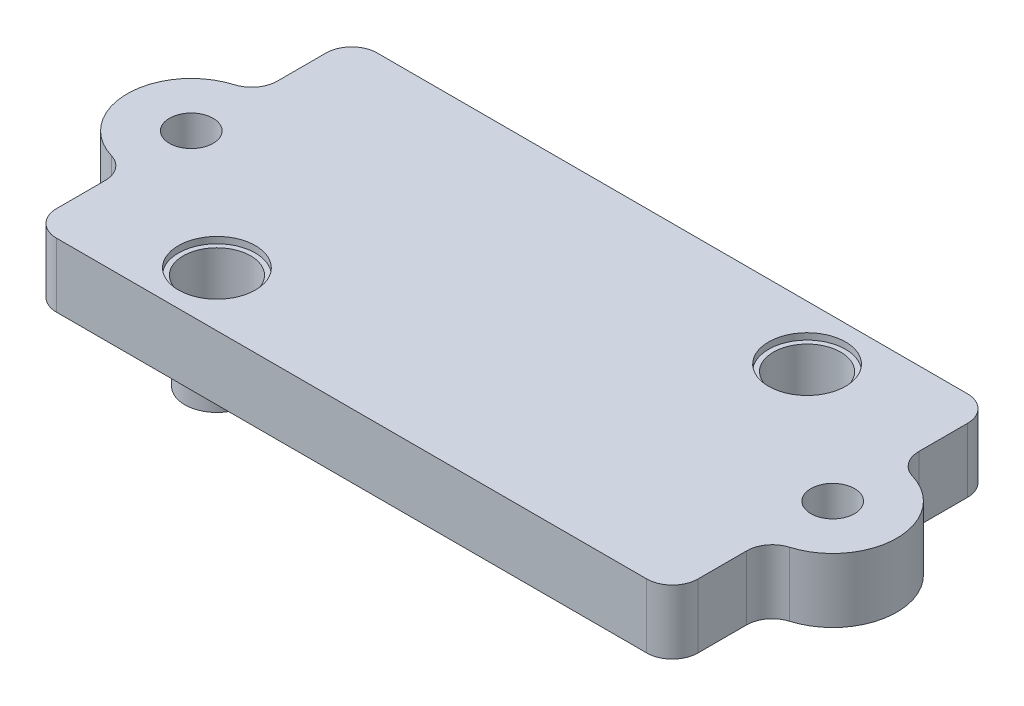
from build123d import *

# Parameters (mm, degrees)
SKETCH1_W                                       = 50
SKETCH1_H                                       = 7.5
BOSS_EXTRUDE1_DEPTH                             = 5
FILLET1_R                                       = 2
SKETCH2_R                                       = 2.5
BOSS_EXTRUDE2_DEPTH                             = 3
CBORE_FOR_M3_SHCS1_D                            = 5.25
CBORE_FOR_M3_SHCS1_DEPTH                        = 4
CBORE_FOR_M3_SHCS1_CBORE_D                      = 6
CBORE_FOR_M3_SHCS1_CBORE_DEPTH                  = 0.5
CBORE_FOR_M3_SHCS1_TIP                          = 1.577259125
CSK_FOR_M3_FLAT_HEAD_MACHINE_SCREW1_D           = 3.4
CSK_FOR_M3_FLAT_HEAD_MACHINE_SCREW1_CSINK_D     = 6.3
CSK_FOR_M3_FLAT_HEAD_MACHINE_SCREW1_CSINK_ANGLE = 90
M3_CLEARANCE_HOLE1_D                            = 3.25
M3_CLEARANCE_HOLE1_DEPTH                        = 4
M3_CLEARANCE_HOLE1_TIP                          = 0.976398506


with BuildPart() as part:
    # Sketch1 → Boss-Extrude1 (new body)
    with BuildSketch(Plane(origin=(0, 0, 0), x_dir=(1, 0, 0), z_dir=(0, 1, 0))):
        with Locations((0, -8.75)):
            Rectangle(SKETCH1_W, SKETCH1_H)
        with BuildLine():
            Line((-25, 2.625), (-25, 5))
            ThreePointArc((-25, 5), (-30, 0), (-25, -5))
            Line((-25, -5), (-25, -2.625))
            ThreePointArc((-25, -2.625), (-27.625, 0), (-25, 2.625))
        make_face()
        with BuildLine():
            Line((25, 5), (-25, 5))
            Line((-25, 5), (-25, 2.625))
            ThreePointArc((-25, 2.625), (-23.143844699, 1.856155301), (-22.375, 0))
            ThreePointArc((-22.375, 0), (-23.143844699, -1.856155301), (-25, -2.625))
            Line((-25, -2.625), (-25, -5))
            Line((-25, -5), (25, -5))
            Line((25, -5), (25, -2.625))
            ThreePointArc((25, -2.625), (22.375, 0), (25, 2.625))
            Line((25, 2.625), (25, 5))
        make_face()
        with Locations((0, 8.75)):
            Rectangle(SKETCH1_W, SKETCH1_H)
        with BuildLine():
            ThreePointArc((25, -5), (30, 0), (25, 5))
            Line((25, 5), (25, 2.625))
            ThreePointArc((25, 2.625), (26.856155301, 1.856155301), (27.625, 0))
            ThreePointArc((27.625, 0), (26.856155301, -1.856155301), (25, -2.625))
            Line((25, -2.625), (25, -5))
        make_face()
        with BuildLine():
            ThreePointArc((-22.375, 0), (-23.143844699, 1.856155301), (-25, 2.625))
            Line((-25, 2.625), (-25, -2.625))
            ThreePointArc((-25, -2.625), (-23.143844699, -1.856155301), (-22.375, 0))
        make_face()
        with BuildLine():
            Line((-25, -2.625), (-25, 2.625))
            ThreePointArc((-25, 2.625), (-27.625, 0), (-25, -2.625))
        make_face()
        with BuildLine():
            ThreePointArc((27.625, 0), (26.856155301, 1.856155301), (25, 2.625))
            Line((25, 2.625), (25, -2.625))
            ThreePointArc((25, -2.625), (26.856155301, -1.856155301), (27.625, 0))
        make_face()
        with BuildLine():
            Line((25, -2.625), (25, 2.625))
            ThreePointArc((25, 2.625), (22.375, 0), (25, -2.625))
        make_face()
    extrude(amount=BOSS_EXTRUDE1_DEPTH)

    # Fillet1
    fillet1_edges = [part.edges().sort_by_distance(p)[0] for p in [
        (25, 2.5, 12.5),
        (-25, 2.5, 12.5),
        (-25, 2.5, 5),
        (-25, 2.5, -5),
        (-25, 2.5, -12.5),
        (25, 2.5, -12.5),
        (25, 2.5, -5),
        (25, 2.5, 5),
    ]]
    fillet(fillet1_edges, radius=FILLET1_R)

    # Sketch2 → Boss-Extrude2 (add)
    with BuildSketch(Plane.XZ):
        with Locations(Location((-14.75, 8.25, 0), (0, 0, 90))):
            Circle(SKETCH2_R)
        with Locations(Location((14.75, -8.25, 0), (0, 0, 90))):
            Circle(SKETCH2_R)
    extrude(amount=BOSS_EXTRUDE2_DEPTH)

    # CBORE for M3 SHCS1
    with Locations(Plane(origin=(0, 5, 0), x_dir=(1, 0, 0), z_dir=(0, 1, 0))):
        with Locations((-14.75, -8.25), (14.75, 8.25)):
            CounterBoreHole(CBORE_FOR_M3_SHCS1_D / 2, CBORE_FOR_M3_SHCS1_CBORE_D / 2, CBORE_FOR_M3_SHCS1_CBORE_DEPTH, depth=CBORE_FOR_M3_SHCS1_DEPTH)
            with Locations((0, 0, -(CBORE_FOR_M3_SHCS1_DEPTH + CBORE_FOR_M3_SHCS1_TIP / 2))):  # 118° drill point
                Cone(0, CBORE_FOR_M3_SHCS1_D / 2, CBORE_FOR_M3_SHCS1_TIP, mode=Mode.SUBTRACT)

    # CSK for M3 Flat Head Machine Screw1 (through all)
    with Locations(Plane.XZ):
        with Locations((-25, 0), (25, 0)):
            CounterSinkHole(CSK_FOR_M3_FLAT_HEAD_MACHINE_SCREW1_D / 2, CSK_FOR_M3_FLAT_HEAD_MACHINE_SCREW1_CSINK_D / 2, counter_sink_angle=CSK_FOR_M3_FLAT_HEAD_MACHINE_SCREW1_CSINK_ANGLE)

    # M3 Clearance Hole1
    with Locations(Plane.XZ.offset(3)):
        with Locations((-14.75, 8.25), (14.75, -8.25)):
            Hole(M3_CLEARANCE_HOLE1_D / 2, depth=M3_CLEARANCE_HOLE1_DEPTH)
            with Locations((0, 0, -(M3_CLEARANCE_HOLE1_DEPTH + M3_CLEARANCE_HOLE1_TIP / 2))):  # 118° drill point
                Cone(0, M3_CLEARANCE_HOLE1_D / 2, M3_CLEARANCE_HOLE1_TIP, mode=Mode.SUBTRACT)


solid = part.part
